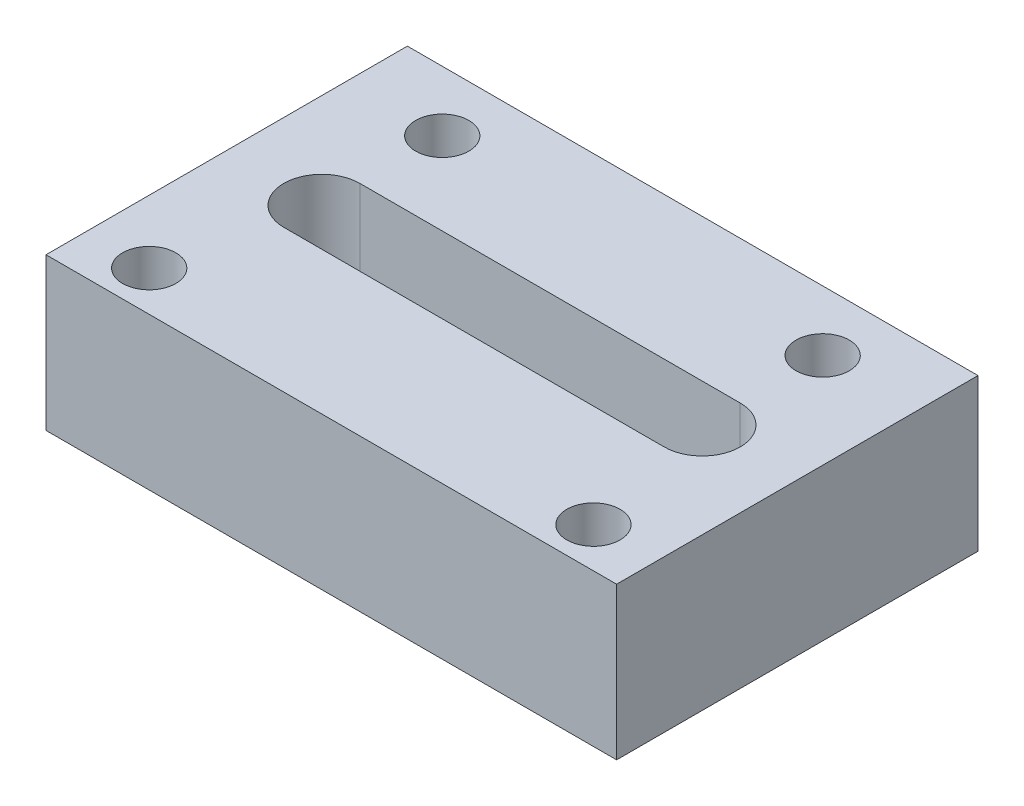
from build123d import *

# Parameters (mm, degrees)
BOSS_EXTRUDE1_DEPTH      = 30
BOSS_EXTRUDE1_DEPTH_BACK = 10
SKETCH1_W                = 150
SKETCH1_H                = 95
SKETCH1_R                = 7


with BuildPart() as part:
    # Sketch1 → Boss-Extrude1 (new, two sides: drawn at the far end of the back side and taken through both)
    with BuildSketch(Plane(origin=(0, 0, 0), x_dir=(1, 0, 0), z_dir=(0, 1, 0)).offset(-BOSS_EXTRUDE1_DEPTH_BACK)):
        Rectangle(SKETCH1_W, SKETCH1_H)
        with Locations(Location((-50, 31.666666667, 0), (0, 0, 270))):
            Circle(SKETCH1_R, mode=Mode.SUBTRACT)
        with Locations(Location((50, 31.666666667, 0), (0, 0, 270))):
            Circle(SKETCH1_R, mode=Mode.SUBTRACT)
        with Locations(Location((-58.389104437, -36.979766144, 0), (0, 0, 270))):
            Circle(SKETCH1_R, mode=Mode.SUBTRACT)
        with Locations(Location((58.389104437, -36.979766144, 0), (0, 0, 270))):
            Circle(SKETCH1_R, mode=Mode.SUBTRACT)
        with BuildLine():
            Line((-50, 10), (50, 10))
            ThreePointArc((50, 10), (60, 0), (50, -10))
            Line((50, -10), (-50, -10))
            ThreePointArc((-50, -10), (-60, 0), (-50, 10))
        make_face(mode=Mode.SUBTRACT)
    extrude(amount=BOSS_EXTRUDE1_DEPTH + BOSS_EXTRUDE1_DEPTH_BACK)


solid = part.part
